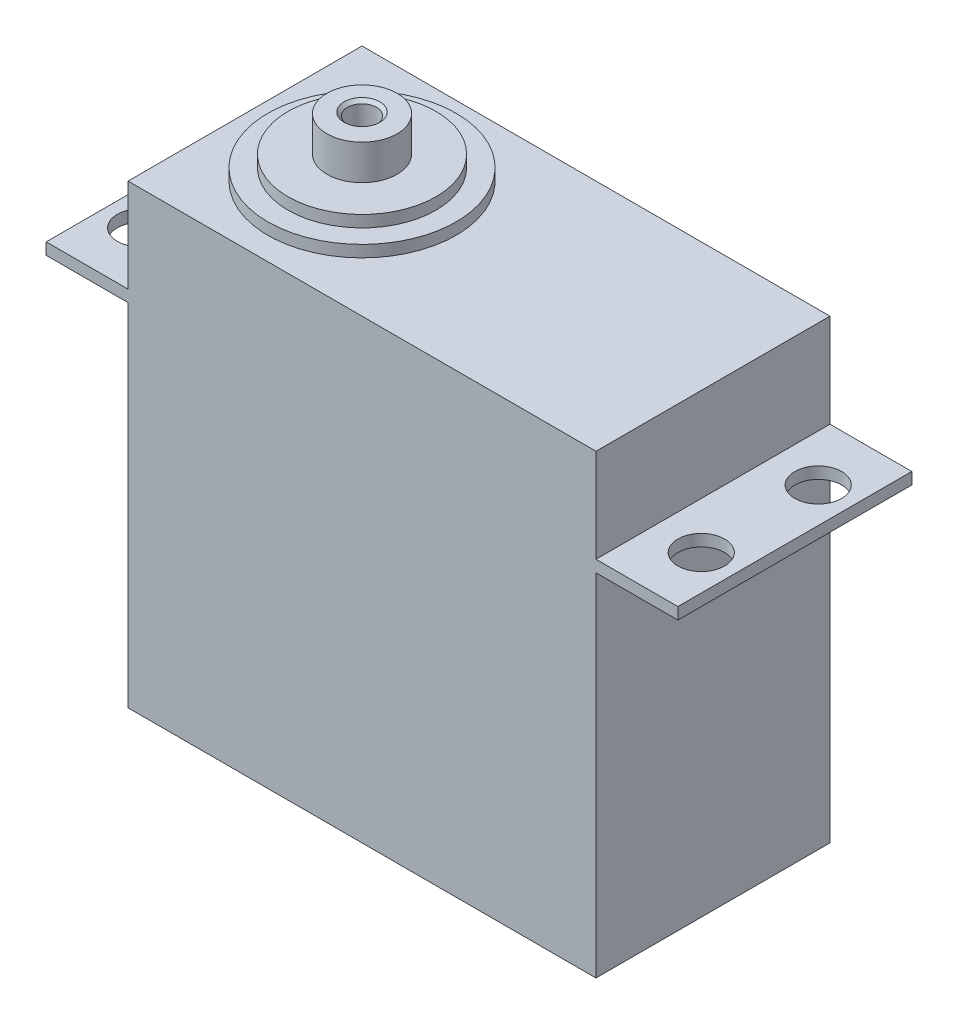
from build123d import *

# Parameters (mm, degrees)
SKETCH_1_W                   = 40
SKETCH_1_H                   = 39
EXTRUDE_1_DEPTH              = 20
SKETCH_2_W                   = 20
SKETCH_2_H                   = 1
EXTRUDE_2_DEPTH              = 7
SKETCH_3_W                   = 20
SKETCH_3_H                   = 1
EXTRUDE_3_DEPTH              = 7
SKETCH_5_R                   = 2
CUT_EXTRUDE_1_DEPTH          = 46.716517803
SKETCH_6_R                   = 2
CUT_EXTRUDE_2_DEPTH          = 46.716517803
SKETCH_7_R                   = 8.045118309
EXTRUDE_4_DEPTH              = 1
SKETCH_8_R                   = 6.323674856
EXTRUDE_5_DEPTH              = 1
SKETCH_9_R                   = 3
EXTRUDE_6_DEPTH              = 3
HOLE_WIZARD_M3_1_D           = 2.5
HOLE_WIZARD_M3_1_DEPTH       = 14.5
HOLE_WIZARD_M3_1_CSINK_D     = 3.05
HOLE_WIZARD_M3_1_CSINK_ANGLE = 90
HOLE_WIZARD_M3_1_TIP         = 0.751075774


with BuildPart() as part:
    # 草图1 → 凸台-拉伸1 (new body)
    with BuildSketch(Plane.XY):
        Rectangle(SKETCH_1_W, SKETCH_1_H)
    extrude(amount=EXTRUDE_1_DEPTH)

    # 草图2 → 凸台-拉伸2 (add)
    with BuildSketch(Plane.ZY.offset(20)):
        with Locations((10, 11)):
            Rectangle(SKETCH_2_W, SKETCH_2_H)
    extrude(amount=EXTRUDE_2_DEPTH)

    # 草图3 → 凸台-拉伸3 (add)
    with BuildSketch(Plane(origin=(20, 0, 0), x_dir=(0, 0, -1), z_dir=(1, 0, 0))):
        with Locations((-10, 11)):
            Rectangle(SKETCH_3_W, SKETCH_3_H)
    extrude(amount=EXTRUDE_3_DEPTH)

    # 草图5 → 切除-拉伸1 (cut, through all)
    with BuildSketch(Plane(origin=(0, 11.5, 0), x_dir=(1, 0, 0), z_dir=(0, 1, 0))):
        with Locations(Location((-24, -5.073781131, 0), (0, 0, 270))):
            Circle(SKETCH_5_R)
        with Locations(Location((-24, -14.926218869, 0), (0, 0, 270))):
            Circle(SKETCH_5_R)
    extrude(amount=-CUT_EXTRUDE_1_DEPTH, mode=Mode.SUBTRACT)

    # 草图6 → 切除-拉伸2 (cut, through all)
    with BuildSketch(Plane(origin=(0, 11.5, 0), x_dir=(1, 0, 0), z_dir=(0, 1, 0))):
        with Locations(Location((24, -5, 0), (0, 0, 180))):
            Circle(SKETCH_6_R)
        with Locations(Location((24, -15, 0), (0, 0, 180))):
            Circle(SKETCH_6_R)
    extrude(amount=-CUT_EXTRUDE_2_DEPTH, mode=Mode.SUBTRACT)

    # 草图7 → 凸台-拉伸4 (add)
    with BuildSketch(Plane(origin=(0, 19.5, 0), x_dir=(1, 0, 0), z_dir=(0, 1, 0))):
        with Locations(Location((-10, -10, 0), (0, 0, 90))):
            Circle(SKETCH_7_R)
    extrude(amount=EXTRUDE_4_DEPTH)

    # 草图8 → 凸台-拉伸5 (add)
    with BuildSketch(Plane(origin=(0, 20.5, 0), x_dir=(1, 0, 0), z_dir=(0, 1, 0))):
        with Locations(Location((-10, -10, 0), (0, 0, 270))):
            Circle(SKETCH_8_R)
    extrude(amount=EXTRUDE_5_DEPTH)

    # 草图9 → 凸台-拉伸6 (add)
    with BuildSketch(Plane(origin=(0, 21.5, 0), x_dir=(1, 0, 0), z_dir=(0, 1, 0))):
        with Locations(Location((-10, -10, 0), (0, 0, 270))):
            Circle(SKETCH_9_R)
    extrude(amount=EXTRUDE_6_DEPTH)

    # M3 螺纹孔1
    with Locations(Plane(origin=(-10.109547736, 24.5, 9.891000731), x_dir=(0, 0, 1), z_dir=(0, 1, 0))):
        with Locations((0, 0)):
            CounterSinkHole(HOLE_WIZARD_M3_1_D / 2, HOLE_WIZARD_M3_1_CSINK_D / 2, depth=HOLE_WIZARD_M3_1_DEPTH, counter_sink_angle=HOLE_WIZARD_M3_1_CSINK_ANGLE)
            with Locations((0, 0, -(HOLE_WIZARD_M3_1_DEPTH + HOLE_WIZARD_M3_1_TIP / 2))):  # 118° drill point
                Cone(0, HOLE_WIZARD_M3_1_D / 2, HOLE_WIZARD_M3_1_TIP, mode=Mode.SUBTRACT)


solid = part.part
